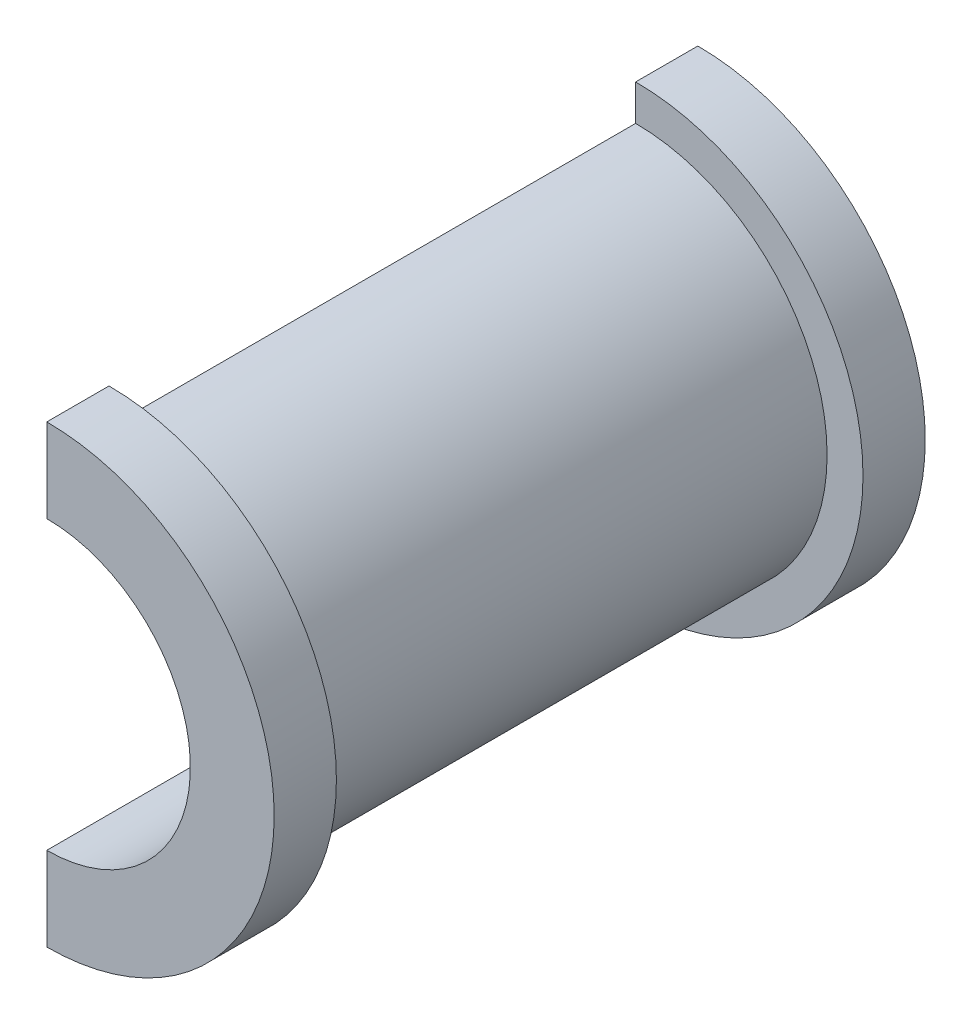
from build123d import *

# Parameters (mm, degrees)
BOSS_EXTRUDE1_DEPTH = 55
BOSS_EXTRUDE2_START = 13
BOSS_EXTRUDE2_DEPTH = 13


with BuildPart() as part:
    # Sketch1 → Boss-Extrude1 (new, symmetric)
    with BuildSketch(Plane.XY):
        with BuildLine():
            Line((0, 40), (0, 30))
            ThreePointArc((0, 30), (30, 0), (0, -30))
            Line((0, -30), (0, -40))
            ThreePointArc((0, -40), (40, 0), (0, 40))
        make_face()
    extrude(amount=BOSS_EXTRUDE1_DEPTH, both=True)

    # Sketch2 → Boss-Extrude2 (add)
    with BuildSketch(Plane.XY.offset(55).offset(BOSS_EXTRUDE2_START)):
        with BuildLine():
            Line((0, 47.5), (0, 30))
            ThreePointArc((0, 30), (30, 0), (0, -30))
            Line((0, -30), (0, -47.5))
            ThreePointArc((0, -47.5), (47.5, 0), (0, 47.5))
        make_face()
    boss_extrude2 = extrude(amount=-BOSS_EXTRUDE2_DEPTH)

    # Mirror1: Boss-Extrude2 across plane
    add(boss_extrude2.mirror(Plane.XY))


solid = part.part
